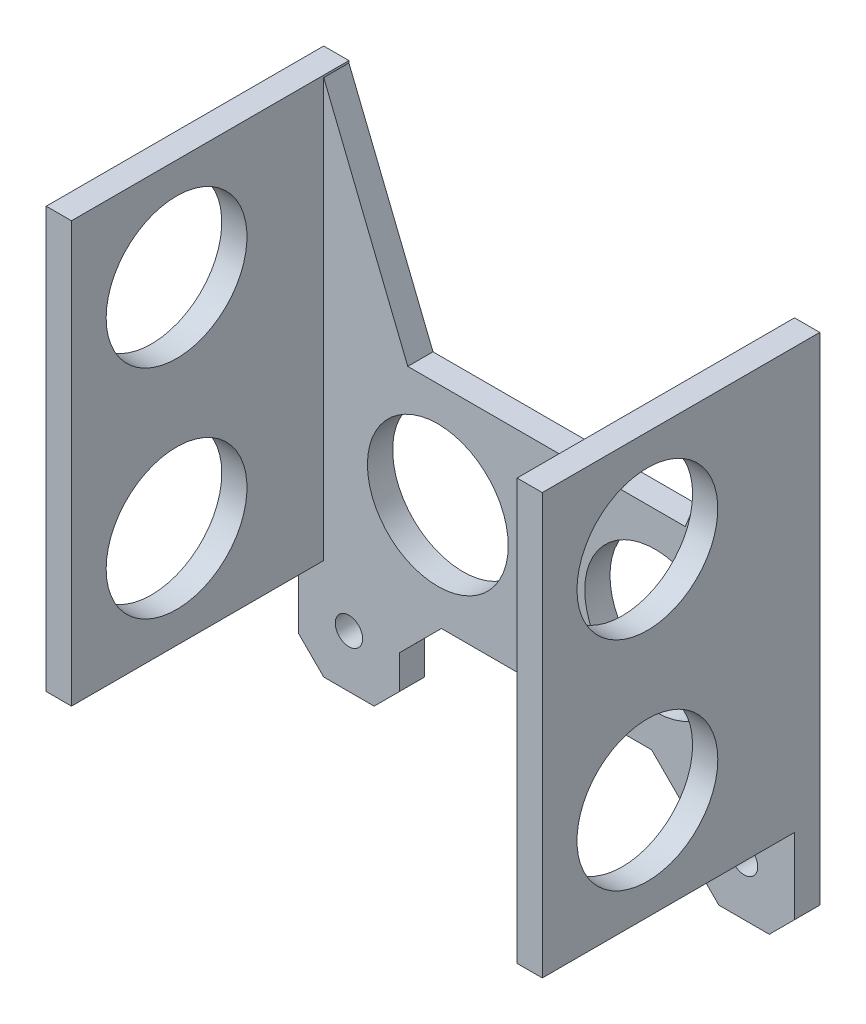
from build123d import *

# Parameters (mm, degrees)
SALIENTE_EXTRUIR1_DEPTH    = 25
CORTAR_EXTRUIR1_DEPTH      = 49.94129136
CORTAR_EXTRUIR1_DEPTH_BACK = 49.94129136
CROQUIS2_R                 = 8.375
SALIENTE_EXTRUIR2_DEPTH    = 3
SALIENTE_EXTRUIR3_DEPTH    = 3
CROQUIS5_R                 = 8.375
CORTAR_EXTRUIR2_DEPTH      = 83.95179323
CHAFL_N1_SIZE              = 10
CHAFL_N1_SIZE2             = 24.750868534
CROQUIS6_R                 = 1.625
SALIENTE_EXTRUIR4_DEPTH    = 3
CHAFL_N2_SIZE              = 3


with BuildPart() as part:
    # Croquis1 → Saliente-Extruir1 (new body)
    with BuildSketch(Plane(origin=(0, 0, 0), x_dir=(1, 0, 0), z_dir=(0, 1, 0))):
        Polygon((-26.5, 0), (-26.5, -30), (-29.5, -30), (-29.5, 3), (29.5, 3), (29.5, -30), (26.5, -30), (26.5, 0), align=None)
    extrude(amount=SALIENTE_EXTRUIR1_DEPTH)

    # Croquis2 → Cortar-Extruir1 (cut, two sides: drawn at the far end of the back side and taken through both)
    with BuildSketch(Plane.XY.offset(-CORTAR_EXTRUIR1_DEPTH_BACK)):
        with Locations((-12.925, 12.5)):
            Circle(CROQUIS2_R)
        with Locations(Location((12.925, 12.5, 0), (0, 0, 180))):
            Circle(CROQUIS2_R)
    extrude(amount=CORTAR_EXTRUIR1_DEPTH + CORTAR_EXTRUIR1_DEPTH_BACK, mode=Mode.SUBTRACT)

    # Croquis3 → Saliente-Extruir2 (add)
    with BuildSketch(Plane.ZY.offset(-26.5)):
        Polygon((0, 25), (30, 25), (30, 50), (0, 50), (-3, 50), (-3, 25), align=None)
    extrude(amount=-SALIENTE_EXTRUIR2_DEPTH)

    # Croquis4 → Saliente-Extruir3 (add)
    with BuildSketch(Plane.ZY.offset(29.5)):
        Polygon((0, 25), (30, 25), (30, 50), (0, 50), (-3, 50), (-3, 25), align=None)
    extrude(amount=-SALIENTE_EXTRUIR3_DEPTH)

    # Croquis5 → Cortar-Extruir2 (cut, through all)
    with BuildSketch(Plane.ZY.offset(29.5)):
        with Locations((17.5, 37.925)):
            Circle(CROQUIS5_R)
        with Locations((17.5, 12.075)):
            Circle(CROQUIS5_R)
    extrude(amount=-CORTAR_EXTRUIR2_DEPTH, mode=Mode.SUBTRACT)

    # Chaflán1
    chafl_n1_edges = [part.edges().sort_by_distance(p)[0] for p in [
        (26.5, 25, -1.5),
        (-26.5, 25, -1.5),
    ]]
    chafl_n1_side = [part.faces().sort_by_distance(p)[0] for p in [
        (0, 25, -1.5),
    ]]
    chamfer(chafl_n1_edges, length=CHAFL_N1_SIZE, length2=CHAFL_N1_SIZE2, reference=chafl_n1_side[0])

    # Croquis6 → Saliente-Extruir4 (add)
    # profile 1 of 2: a face of its own
    with BuildSketch(Plane.XY):
        Polygon((-29.5, 0), (-17.5, 0), (-12.5, 0), (-17.5, -5.001983983), (-17.5, -12), (-29.5, -12), align=None)
        with Locations((-23.5, -5.75)):
            Circle(CROQUIS6_R, mode=Mode.SUBTRACT)
    # profile 2 of 2: a face of its own
    with BuildSketch(Plane.XY):
        Polygon((12.5, 0), (17.5, 0), (29.5, 0), (29.5, -12), (17.5, -12), (17.5, -5.001983983), align=None)
        with Locations(Location((23.5, -5.75, 0), (0, 0, 180))):
            Circle(CROQUIS6_R, mode=Mode.SUBTRACT)
    extrude(amount=-SALIENTE_EXTRUIR4_DEPTH)

    # Chaflán2
    chafl_n2_edges = [part.edges().sort_by_distance(p)[0] for p in [
        (-29.5, -12, -1.5),
        (-17.5, -12, -1.5),
        (29.5, -12, -1.5),
        (17.5, -12, -1.5),
    ]]
    chamfer(chafl_n2_edges, length=CHAFL_N2_SIZE)


solid = part.part
